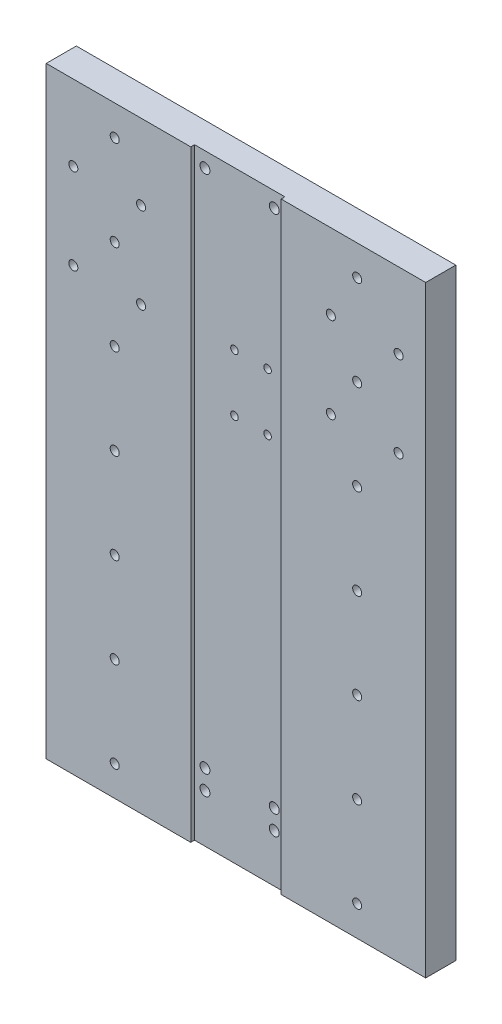
from build123d import *

# Parameters (mm, degrees)
SCHIZZO1_W                   = 252
SCHIZZO1_H                   = 400
ESTRUSIONE_ESTRUSIONE1_DEPTH = 20
SCHIZZO3_W                   = 60
SCHIZZO3_H                   = 12.0854414
TAGLIO_ESTRUSIONE1_DEPTH     = 420.852355001
SCHIZZO4_R                   = 3.3
TAGLIO_ESTRUSIONE2_DEPTH     = 238.027951938
SCHIZZO5_R                   = 3
TAGLIO_ESTRUSIONE3_DEPTH     = 238.225630993
SCHIZZO6_R                   = 3
SCHIZZO6_R_2                 = 2.5
TAGLIO_ESTRUSIONE4_DEPTH     = 238.225630993


with BuildPart() as part:
    # Schizzo1 → Estrusione-Estrusione1 (new body)
    with BuildSketch(Plane.XY):
        Rectangle(SCHIZZO1_W, SCHIZZO1_H)
    extrude(amount=ESTRUSIONE_ESTRUSIONE1_DEPTH)

    # Schizzo3 → Taglio-Estrusione1 (cut, through all)
    with BuildSketch(Plane(origin=(0, 200, 0), x_dir=(1, 0, 0), z_dir=(0, 1, 0))):
        with Locations((0, -23.5427207)):
            Rectangle(SCHIZZO3_W, SCHIZZO3_H)
    extrude(amount=-TAGLIO_ESTRUSIONE1_DEPTH, mode=Mode.SUBTRACT)

    # Schizzo4 → Taglio-Estrusione2 (cut, through all)
    with BuildSketch(Plane.XY.offset(17.5)):
        with Locations((22.92355164, 190)):
            Circle(SCHIZZO4_R)
        with Locations((-23.07644836, 190)):
            Circle(SCHIZZO4_R)
        with Locations((22.92355164, -155)):
            Circle(SCHIZZO4_R)
        with Locations((-23.07644836, -155)):
            Circle(SCHIZZO4_R)
        with Locations((22.92355164, -168)):
            Circle(SCHIZZO4_R)
        with Locations((-23.07644836, -168)):
            Circle(SCHIZZO4_R)
    extrude(amount=-TAGLIO_ESTRUSIONE2_DEPTH, mode=Mode.SUBTRACT)

    # Schizzo5 → Taglio-Estrusione3 (cut, through all)
    with BuildSketch(Plane.XY.offset(20)):
        with Locations((80.500605801, -120)):
            Circle(SCHIZZO5_R)
        with Locations((80.500605801, -180)):
            Circle(SCHIZZO5_R)
        with Locations((80.500605801, 180)):
            Circle(SCHIZZO5_R)
        with Locations((80.500605801, 120)):
            Circle(SCHIZZO5_R)
        with Locations((80.500605801, 60)):
            Circle(SCHIZZO5_R)
        with Locations((80.500605801, 0)):
            Circle(SCHIZZO5_R)
        with Locations((80.500605801, -60)):
            Circle(SCHIZZO5_R)
    taglio_estrusione3 = extrude(amount=-TAGLIO_ESTRUSIONE3_DEPTH, mode=Mode.SUBTRACT)

    # Specchia1: Taglio-Estrusione3 across plane
    add(taglio_estrusione3.mirror(Plane(origin=(0, 0, 0), x_dir=(0, 0, 1), z_dir=(1, 0, 0))), mode=Mode.SUBTRACT)

    # Schizzo6 → Taglio-Estrusione4 (cut, through all)
    with BuildSketch(Plane.XY.offset(20)):
        with Locations((108, 92.808299679)):
            Circle(SCHIZZO6_R)
        with Locations((63, 92.808299679)):
            Circle(SCHIZZO6_R)
        with Locations((108, 149.808299679)):
            Circle(SCHIZZO6_R)
        with Locations((63, 149.808299679)):
            Circle(SCHIZZO6_R)
        with Locations((-3.5, 95.308299679)):
            Circle(SCHIZZO6_R_2)
        with Locations((18.5, 95.308299679)):
            Circle(SCHIZZO6_R_2)
        with Locations((-3.5, 57.308299679)):
            Circle(SCHIZZO6_R_2)
        with Locations((18.5, 57.308299679)):
            Circle(SCHIZZO6_R_2)
        with Locations((-63, 92.808299679)):
            Circle(SCHIZZO6_R)
        with Locations((-108, 92.808299679)):
            Circle(SCHIZZO6_R)
        with Locations((-63, 149.808299679)):
            Circle(SCHIZZO6_R)
        with Locations((-108, 149.808299679)):
            Circle(SCHIZZO6_R)
    extrude(amount=-TAGLIO_ESTRUSIONE4_DEPTH, mode=Mode.SUBTRACT)


solid = part.part
